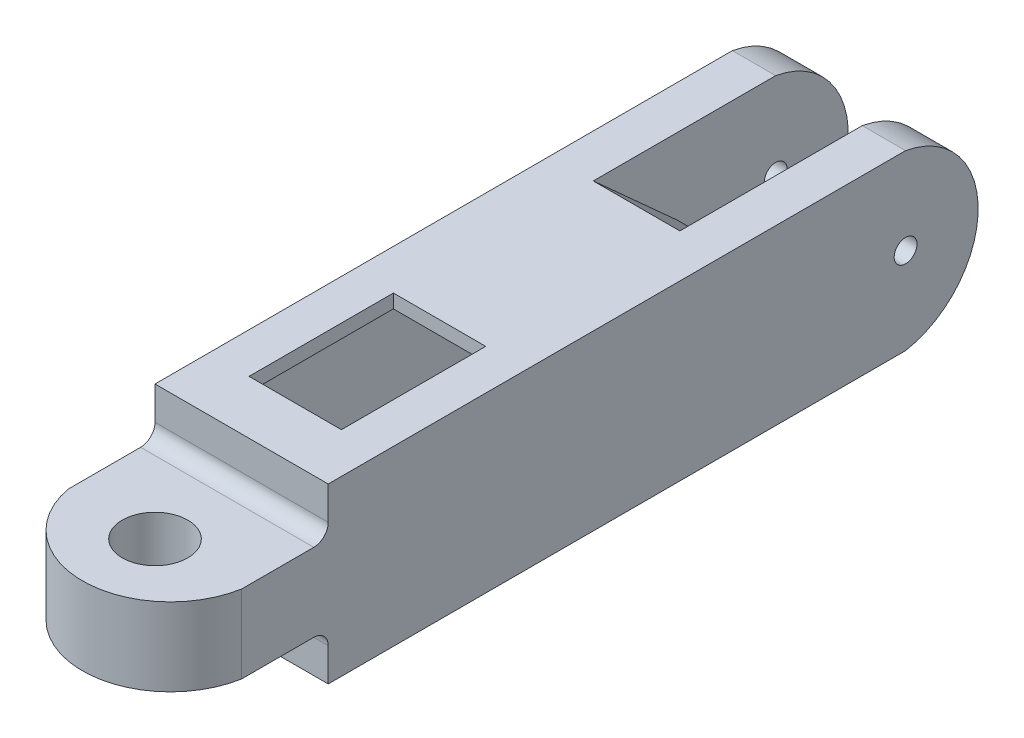
from build123d import *

# Parameters (mm, degrees)
SKETCH2_W               = 60
SKETCH2_H               = 60
BOSS_EXTRUDE1_DEPTH     = 170
SKETCH3_W               = 15
SKETCH3_H               = 60
BOSS_EXTRUDE2_DEPTH     = 30
BOSS_EXTRUDE3_DEPTH     = 15
BOSS_EXTRUDE4_START     = -15
BOSS_EXTRUDE4_DEPTH     = 15
SKETCH6_W               = 60
SKETCH6_H               = 27
BOSS_EXTRUDE5_DEPTH     = 30
BOSS_EXTRUDE6_DEPTH     = 27
CUT_EXTRUDE2_DEPTH      = 5
CUT_EXTRUDE2_DEPTH_BACK = 130
CUT_EXTRUDE2_START      = -10
SKETCH8_W               = 50.5
SKETCH8_H               = 50.5
SKETCH9_R               = 11.35
CUT_EXTRUDE3_DEPTH      = 130
SKETCH11_R              = 3.95
CUT_EXTRUDE4_DEPTH      = 232.543759953
SKETCH12_R              = 3.95
CUT_EXTRUDE5_DEPTH      = 232.543759953
CUT_EXTRUDE7_DEPTH      = 30
FILLET2_R               = 5
FILLET3_R               = 5
SKETCH16_W              = 16
SKETCH16_H              = 11.5
CUT_EXTRUDE8_DEPTH      = 71


with BuildPart() as part:
    # Sketch2 → Boss-Extrude1 (new body)
    with BuildSketch(Plane.XY):
        Rectangle(SKETCH2_W, SKETCH2_H)
    extrude(amount=BOSS_EXTRUDE1_DEPTH)

    # Sketch3 → Boss-Extrude2 (add)
    with BuildSketch(Plane(origin=(0, 0, 0), x_dir=(-1, 0, 0), z_dir=(0, 0, -1))):
        with Locations((22.5, 0)):
            Rectangle(SKETCH3_W, SKETCH3_H)
        with Locations((-22.5, 0)):
            Rectangle(SKETCH3_W, SKETCH3_H)
    extrude(amount=BOSS_EXTRUDE2_DEPTH)

    # Sketch4 → Boss-Extrude3 (add)
    with BuildSketch(Plane(origin=(30, 0, 0), x_dir=(0, 0, -1), z_dir=(1, 0, 0))):
        with BuildLine():
            Line((30, 30), (30, -30))
            ThreePointArc((30, -30), (55.138874415, 0), (30, 30))
        make_face()
    extrude(amount=-BOSS_EXTRUDE3_DEPTH)

    # Sketch5 → Boss-Extrude4 (add)
    with BuildSketch(Plane.ZY.offset(30).offset(BOSS_EXTRUDE4_START)):
        with BuildLine():
            Line((-30, -30), (-30, 30))
            ThreePointArc((-30, 30), (-55.138874415, 0), (-30, -30))
        make_face()
    extrude(amount=BOSS_EXTRUDE4_DEPTH)

    # Sketch6 → Boss-Extrude5 (add)
    with BuildSketch(Plane.XY.offset(170)):
        Rectangle(SKETCH6_W, SKETCH6_H)
    extrude(amount=BOSS_EXTRUDE5_DEPTH)

    # Sketch7 → Boss-Extrude6 (add)
    with BuildSketch(Plane(origin=(0, 13.5, 0), x_dir=(1, 0, 0), z_dir=(0, 1, 0))):
        with BuildLine():
            Line((30, -200), (-30, -200))
            ThreePointArc((-30, -200), (0, -225.138874415), (30, -200))
        make_face()
    extrude(amount=-BOSS_EXTRUDE6_DEPTH)

    # Sketch8 → Cut-Extrude2 (cut, two sides: drawn at the far end of the back side and taken through both)
    with BuildSketch(Plane.XY.offset(170).offset(CUT_EXTRUDE2_START - CUT_EXTRUDE2_DEPTH_BACK)):
        Rectangle(SKETCH8_W, SKETCH8_H)
    extrude(amount=CUT_EXTRUDE2_DEPTH + CUT_EXTRUDE2_DEPTH_BACK, mode=Mode.SUBTRACT)

    # Sketch9 → Cut-Extrude3 (cut)
    with BuildSketch(Plane(origin=(0, -13.5, 0), x_dir=(-1, 0, 0), z_dir=(0, -1, 0))):
        with Locations(Location((0, -200, 0), (0, 0, 90))):
            Circle(SKETCH9_R)
    extrude(amount=-CUT_EXTRUDE3_DEPTH, mode=Mode.SUBTRACT)

    # Sketch11 → Cut-Extrude4 (cut, through all)
    with BuildSketch(Plane.ZY.offset(-15)):
        with Locations(Location((-30, 0, 0), (0, 0, 270))):
            Circle(SKETCH11_R)
    extrude(amount=-CUT_EXTRUDE4_DEPTH, mode=Mode.SUBTRACT)

    # Sketch12 → Cut-Extrude5 (cut, through all)
    with BuildSketch(Plane(origin=(-15, 0, 0), x_dir=(0, 0, -1), z_dir=(1, 0, 0))):
        with Locations(Location((30, 0, 0), (0, 0, 270))):
            Circle(SKETCH12_R)
    extrude(amount=-CUT_EXTRUDE5_DEPTH, mode=Mode.SUBTRACT)

    # Sketch14 → Cut-Extrude7 (cut)
    with BuildSketch(Plane(origin=(-15, 0, 0), x_dir=(0, 0, -1), z_dir=(1, 0, 0))):
        Polygon((0, -30), (0, 0), (-33.188384016, -30), align=None)
        Polygon((-33.188384016, 30), (0, 0), (0, 30), align=None)
    extrude(amount=CUT_EXTRUDE7_DEPTH, mode=Mode.SUBTRACT)

    # Fillet2
    fillet2_edges = [part.edges().sort_by_distance(p)[0] for p in [
        (0, 0, 0),
    ]]
    fillet(fillet2_edges, radius=FILLET2_R)

    # Fillet3
    fillet3_edges = [part.edges().sort_by_distance(p)[0] for p in [
        (0, 13.5, 170),
        (0, -13.5, 170),
    ]]
    fillet(fillet3_edges, radius=FILLET3_R)

    # Sketch16 → Cut-Extrude8 (cut)
    with BuildSketch(Plane(origin=(0, 30, 0), x_dir=(1, 0, 0), z_dir=(0, 1, 0))):
        Polygon((16, -151.43), (16, -101.43), (-16, -101.43), (-16, -139.93), (0, -139.93), (0, -151.43), align=None)
        with Locations((-8, -145.68)):
            Rectangle(SKETCH16_W, SKETCH16_H)
    extrude(amount=-CUT_EXTRUDE8_DEPTH, mode=Mode.SUBTRACT)


solid = part.part
